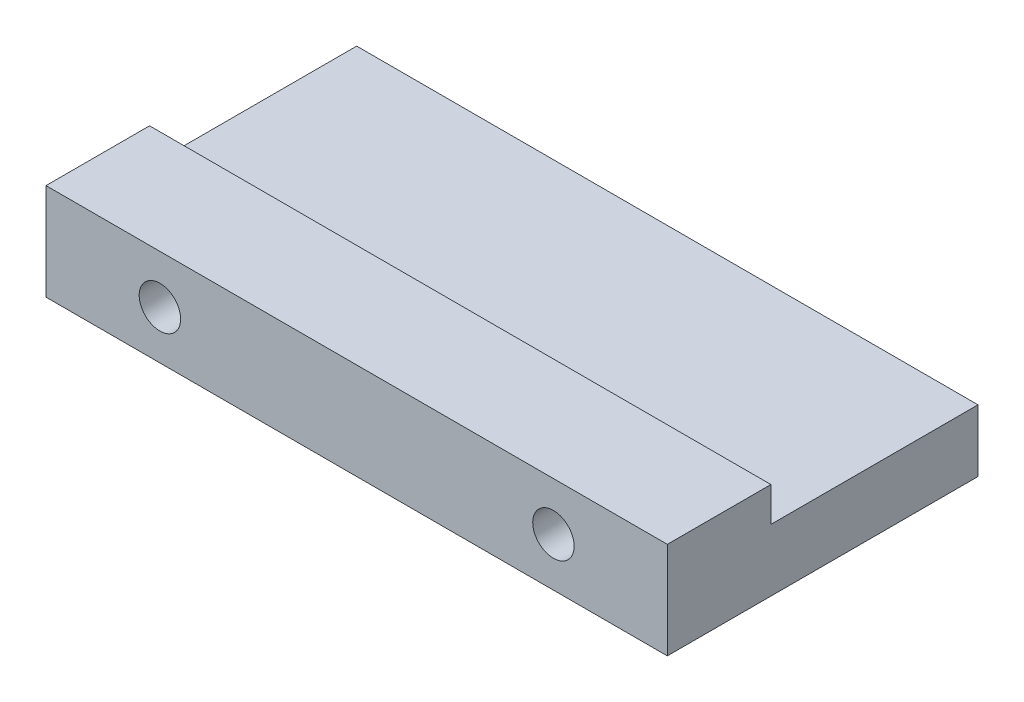
from build123d import *

# Parameters (mm, degrees)
SKETCH_1_W          = 180
SKETCH_1_H          = 28
EXTRUDE_1_DEPTH     = 90
SKETCH_2_R          = 6
CUT_EXTRUDE_1_DEPTH = 30
SKETCH_3_W          = 180
SKETCH_3_H          = 60
CUT_EXTRUDE_2_DEPTH = 10


with BuildPart() as part:
    # 草图1 → 拉伸1 (new body)
    with BuildSketch(Plane.XY):
        with Locations((90, -14)):
            Rectangle(SKETCH_1_W, SKETCH_1_H)
    extrude(amount=EXTRUDE_1_DEPTH)

    # 草图2 → 切除-拉伸1 (cut)
    with BuildSketch(Plane.XY.offset(90)):
        with Locations((33, -14)):
            Circle(SKETCH_2_R)
        with Locations(Location((147, -14, 0), (0, 0, 180))):
            Circle(SKETCH_2_R)
    extrude(amount=-CUT_EXTRUDE_1_DEPTH, mode=Mode.SUBTRACT)

    # 草图3 → 切除-拉伸2 (cut)
    with BuildSketch(Plane(origin=(0, 0, 0), x_dir=(1, 0, 0), z_dir=(0, 1, 0))):
        with Locations((90, -30)):
            Rectangle(SKETCH_3_W, SKETCH_3_H)
    extrude(amount=-CUT_EXTRUDE_2_DEPTH, mode=Mode.SUBTRACT)


solid = part.part
